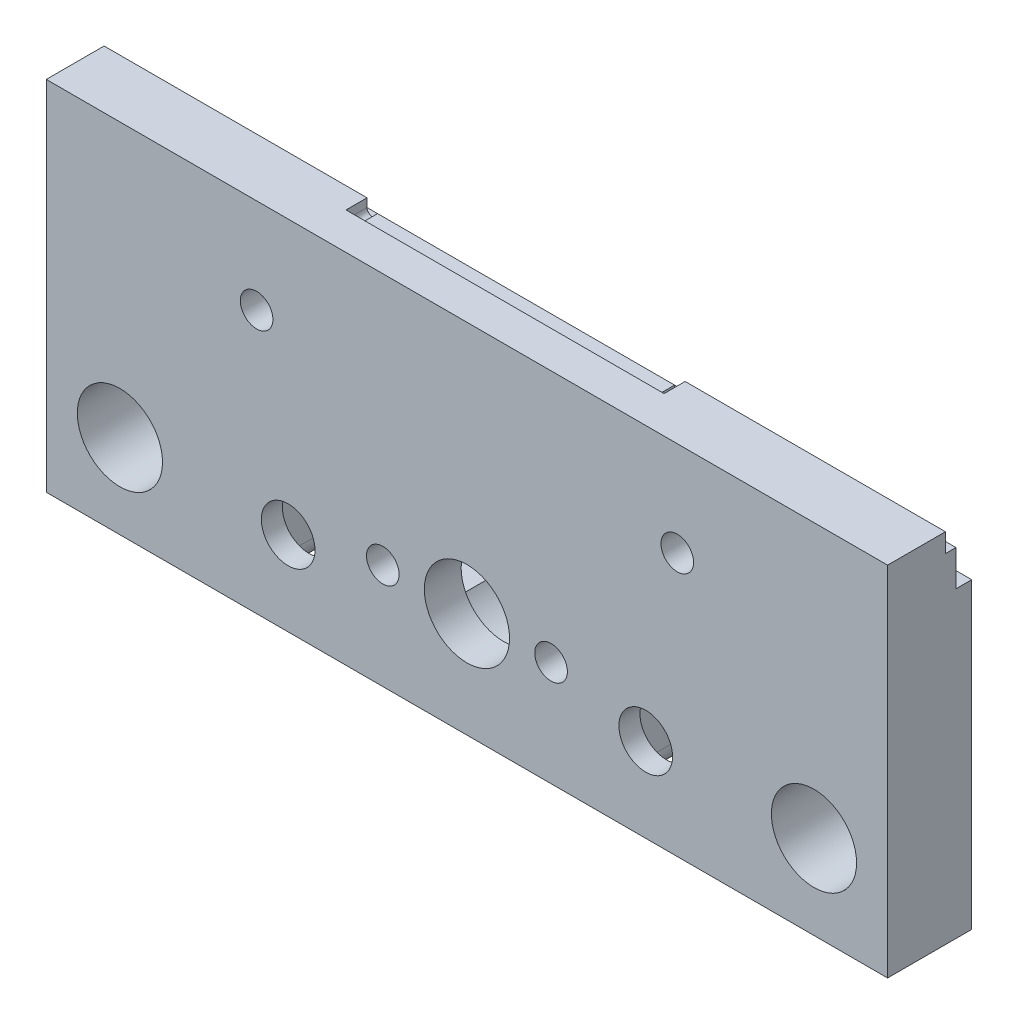
from build123d import *

# Parameters (mm, degrees)
SKETCH_2_W           = 80
SKETCH_2_H           = 34
SKETCH_2_R           = 4.05
EXTRUDE_1_DEPTH      = 8
SKETCH_3_R           = 2.55
CUT_EXTRUDE_1_DEPTH  = 88.292611371
CUT_EXTRUDE_2_DEPTH  = 88.292611371
SKETCH_5_R           = 1.55
CUT_EXTRUDE_3_DEPTH  = 88.292611371
CUT_EXTRUDE_4_DEPTH  = 6
CUT_EXTRUDE_5_DEPTH  = 4.5
SKETCH_20_R          = 5.5
CUT_EXTRUDE_12_DEPTH = 4.5
SKETCH_11_R          = 1.55
CUT_EXTRUDE_7_DEPTH  = 88.292611371
CUT_EXTRUDE_11_DEPTH = 2


with BuildPart() as part:
    # 草图2 → 凸台-拉伸1 (new body)
    with BuildSketch(Plane.XY):
        with Locations((40, 17)):
            Rectangle(SKETCH_2_W, SKETCH_2_H)
        with Locations((7, 8)):
            Circle(SKETCH_2_R, mode=Mode.SUBTRACT)
        with Locations((40, 10)):
            Circle(SKETCH_2_R, mode=Mode.SUBTRACT)
        with Locations((73, 8)):
            Circle(SKETCH_2_R, mode=Mode.SUBTRACT)
    extrude(amount=EXTRUDE_1_DEPTH)

    # 草图3 → 切除-拉伸1 (cut, through all)
    with BuildSketch(Plane.XY.offset(8)):
        with Locations((23, 8)):
            Circle(SKETCH_3_R)
        with Locations((57, 8)):
            Circle(SKETCH_3_R)
    extrude(amount=-CUT_EXTRUDE_1_DEPTH, mode=Mode.SUBTRACT)

    # 草图4 → 切除-拉伸2 (cut, through all)
    with BuildSketch(Plane(origin=(80, 0, 0), x_dir=(0, 0, -1), z_dir=(1, 0, 0))):
        Polygon((-1.5, 32.2), (-2.5, 32.2), (-2.5, 34), (0, 34), (0, 28.8), (-1.5, 28.8), align=None)
    extrude(amount=-CUT_EXTRUDE_2_DEPTH, mode=Mode.SUBTRACT)

    # 草图5 → 切除-拉伸3 (cut, through all)
    with BuildSketch(Plane.XY.offset(8)):
        with Locations((48, 10)):
            Circle(SKETCH_5_R)
        with Locations((32, 10)):
            Circle(SKETCH_5_R)
    extrude(amount=-CUT_EXTRUDE_3_DEPTH, mode=Mode.SUBTRACT)

    # 草图7 → 切除-拉伸4 (cut)
    with BuildSketch(Plane(origin=(0, 0, 0), x_dir=(-1, 0, 0), z_dir=(0, 0, -1))):
        with BuildLine():
            Line((-27.05, 10), (-27.05, 2.5))
            ThreePointArc((-27.05, 2.5), (-27.782233047, 0.732233047), (-29.55, 0))
            Line((-29.55, 0), (-16.45, 0))
            ThreePointArc((-16.45, 0), (-18.217766953, 0.732233047), (-18.95, 2.5))
            Line((-18.95, 2.5), (-18.95, 10))
            ThreePointArc((-18.95, 10), (-23, 14.05), (-27.05, 10))
        make_face()
        with BuildLine():
            Line((-61.05, 2.5), (-61.05, 10))
            ThreePointArc((-61.05, 10), (-57, 14.05), (-52.95, 10))
            Line((-52.95, 10), (-52.95, 2.5))
            ThreePointArc((-52.95, 2.5), (-52.217766953, 0.732233047), (-50.45, 0))
            Line((-50.45, 0), (-63.55, 0))
            ThreePointArc((-63.55, 0), (-61.782233047, 0.732233047), (-61.05, 2.5))
        make_face()
    extrude(amount=-CUT_EXTRUDE_4_DEPTH, mode=Mode.SUBTRACT)

    # 草图8 → 切除-拉伸5 (cut)
    with BuildSketch(Plane(origin=(0, 0, 0), x_dir=(-1, 0, 0), z_dir=(0, 0, -1))):
        with BuildLine():
            Line((-30.5, 12.85), (-49.5, 12.85))
            ThreePointArc((-49.5, 12.85), (-52.35, 10), (-49.5, 7.15))
            Line((-49.5, 7.15), (-30.5, 7.15))
            ThreePointArc((-30.5, 7.15), (-27.65, 10), (-30.5, 12.85))
        make_face()
    extrude(amount=-CUT_EXTRUDE_5_DEPTH, mode=Mode.SUBTRACT)

    # 草图20 → 切除-拉伸12 (cut)
    with BuildSketch(Plane(origin=(0, 0, 0), x_dir=(-1, 0, 0), z_dir=(0, 0, -1))):
        with Locations((-40, 10)):
            Circle(SKETCH_20_R)
    extrude(amount=-CUT_EXTRUDE_12_DEPTH, mode=Mode.SUBTRACT)

    # 草图11 → 切除-拉伸7 (cut, through all)
    with BuildSketch(Plane(origin=(0, 0, 0), x_dir=(-1, 0, 0), z_dir=(0, 0, -1))):
        with Locations((-60, 25)):
            Circle(SKETCH_11_R)
        with Locations((-20, 25)):
            Circle(SKETCH_11_R)
    extrude(amount=-CUT_EXTRUDE_7_DEPTH, mode=Mode.SUBTRACT)

    # 草图19 → 切除-拉伸11 (cut)
    with BuildSketch(Plane(origin=(0, 0, 2.5), x_dir=(-1, 0, 0), z_dir=(0, 0, -1))):
        with BuildLine():
            Line((-25, 34), (-55.247938178, 34))
            Line((-55.247938178, 34), (-55.247938178, 33.2))
            ThreePointArc((-55.247938178, 33.2), (-54.747938178, 32.7), (-54.247938178, 33.2))
            Line((-54.247938178, 33.2), (-26, 33.2))
            ThreePointArc((-26, 33.2), (-25.5, 32.7), (-25, 33.2))
            Line((-25, 33.2), (-25, 34))
        make_face()
    extrude(amount=-CUT_EXTRUDE_11_DEPTH, mode=Mode.SUBTRACT)


solid = part.part
